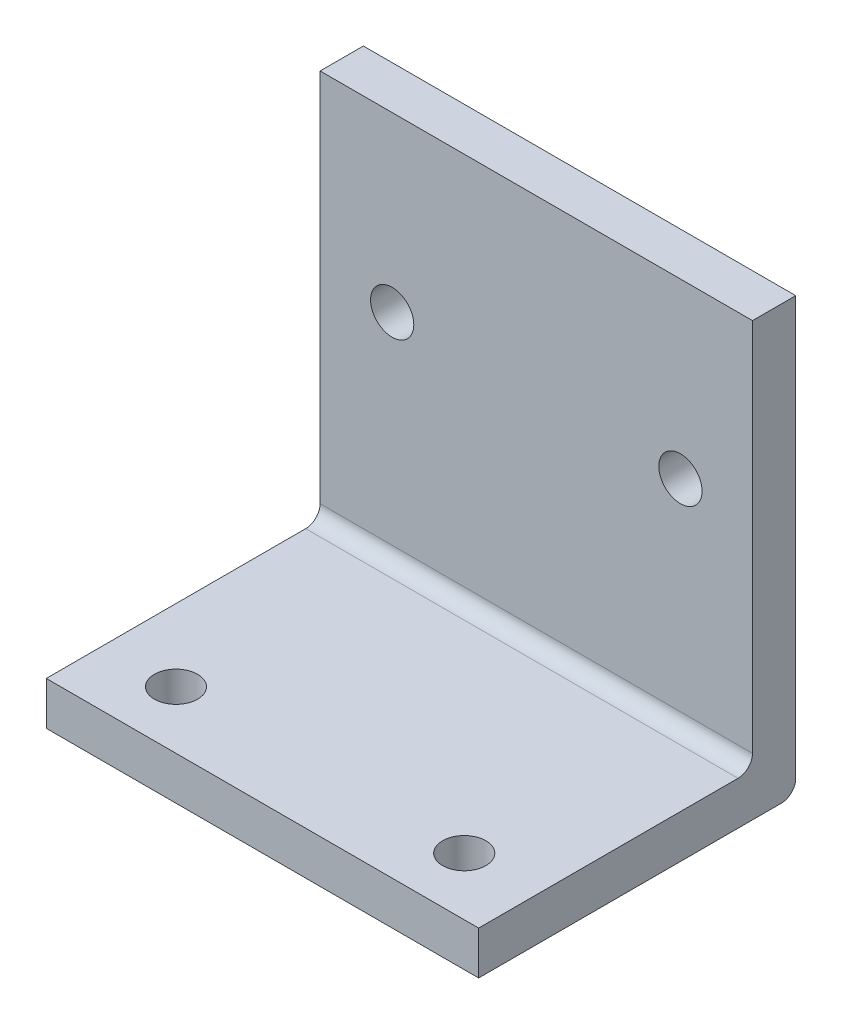
from build123d import *

# Parameters (mm, degrees)
SKETCH_1_W          = 30
SKETCH_1_H          = 30
EXTRUDE_1_DEPTH     = 3
SKETCH_2_R          = 1.5
CUT_EXTRUDE_1_DEPTH = 3.5
SKETCH_3_W          = 30
SKETCH_3_H          = 3
EXTRUDE_2_DEPTH     = 27
SKETCH_4_R          = 1.5
CUT_EXTRUDE_2_DEPTH = 27
FILLET_1_R          = 1
FILLET_2_R          = 1
SKETCH_5_W          = 30
SKETCH_5_H          = 8
CUT_EXTRUDE_3_DEPTH = 10


with BuildPart() as part:
    # 草图1 → 凸台-拉伸1 (new body)
    with BuildSketch(Plane.XY):
        Rectangle(SKETCH_1_W, SKETCH_1_H)
    extrude(amount=EXTRUDE_1_DEPTH)

    # 草图2 → 切除-拉伸1 (cut)
    with BuildSketch(Plane.XY.offset(3)):
        with Locations((10, 3)):
            Circle(SKETCH_2_R)
        with Locations((-10, 3)):
            Circle(SKETCH_2_R)
    extrude(amount=-CUT_EXTRUDE_1_DEPTH, mode=Mode.SUBTRACT)

    # 草图3 → 凸台-拉伸2 (add)
    with BuildSketch(Plane.XY.offset(3)):
        with Locations((0, -13.5)):
            Rectangle(SKETCH_3_W, SKETCH_3_H)
    extrude(amount=EXTRUDE_2_DEPTH)

    # 草图4 → 切除-拉伸2 (cut)
    with BuildSketch(Plane(origin=(0, -12, 0), x_dir=(1, 0, 0), z_dir=(0, 1, 0))):
        with Locations(Location((10, -18, 0), (0, 0, 270))):
            Circle(SKETCH_4_R)
        with Locations(Location((-10, -18, 0), (0, 0, 270))):
            Circle(SKETCH_4_R)
    extrude(amount=-CUT_EXTRUDE_2_DEPTH, mode=Mode.SUBTRACT)

    # 圆角1
    fillet_1_edges = [part.edges().sort_by_distance(p)[0] for p in [
        (0, -12, 3),
    ]]
    fillet(fillet_1_edges, radius=FILLET_1_R)

    # 圆角2
    fillet_2_edges = [part.edges().sort_by_distance(p)[0] for p in [
        (0, -15, 0),
    ]]
    fillet(fillet_2_edges, radius=FILLET_2_R)

    # 草图5 → 切除-拉伸3 (cut)
    with BuildSketch(Plane(origin=(0, -12, 0), x_dir=(1, 0, 0), z_dir=(0, 1, 0))):
        with Locations((0, -26)):
            Rectangle(SKETCH_5_W, SKETCH_5_H)
    extrude(amount=-CUT_EXTRUDE_3_DEPTH, mode=Mode.SUBTRACT)


solid = part.part
